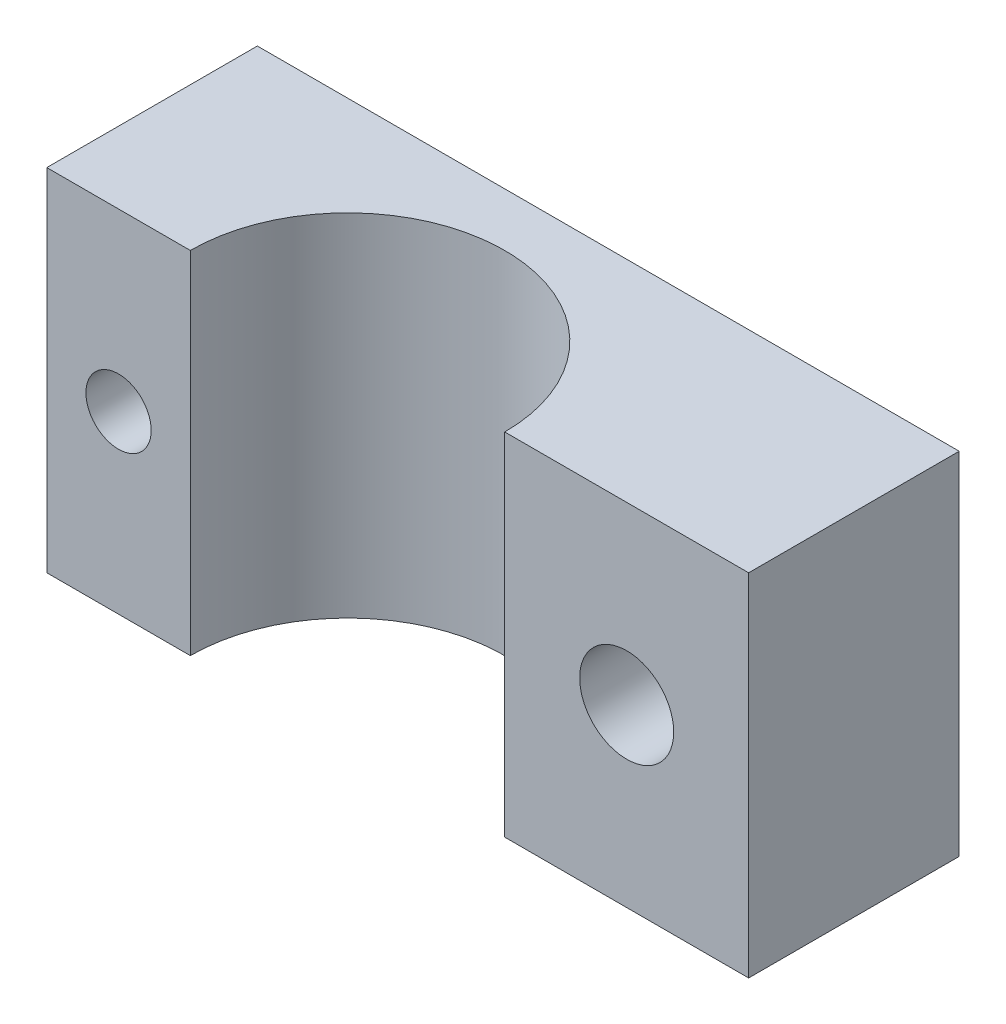
from build123d import *

# Parameters (mm, degrees)
SKETCH1_W           = 50
SKETCH1_H           = 15
BOSS_EXTRUDE1_DEPTH = 25
SKETCH4_R           = 11.2
CUT_EXTRUDE3_DEPTH  = 58.879184514
SKETCH5_R           = 2.325
SKETCH5_R_2         = 3.35
CUT_EXTRUDE4_DEPTH  = 58.879184514


with BuildPart() as part:
    # Sketch1 → Boss-Extrude1 (new body)
    with BuildSketch(Plane(origin=(0, 0, 0), x_dir=(1, 0, 0), z_dir=(0, 1, 0))):
        with Locations((25, 7.5)):
            Rectangle(SKETCH1_W, SKETCH1_H)
    extrude(amount=BOSS_EXTRUDE1_DEPTH)

    # Sketch4 → Cut-Extrude3 (cut, through all)
    with BuildSketch(Plane(origin=(0, 0, 0), x_dir=(1, 0, 0), z_dir=(0, 1, 0))):
        with Locations((21.42346, 0)):
            Circle(SKETCH4_R)
    extrude(amount=CUT_EXTRUDE3_DEPTH, mode=Mode.SUBTRACT)

    # Sketch5 → Cut-Extrude4 (cut, through all)
    with BuildSketch(Plane.XY):
        with Locations((5.11173, 12.5)):
            Circle(SKETCH5_R)
        with Locations((41.31173, 12.5)):
            Circle(SKETCH5_R_2)
    extrude(amount=-CUT_EXTRUDE4_DEPTH, mode=Mode.SUBTRACT)


solid = part.part
